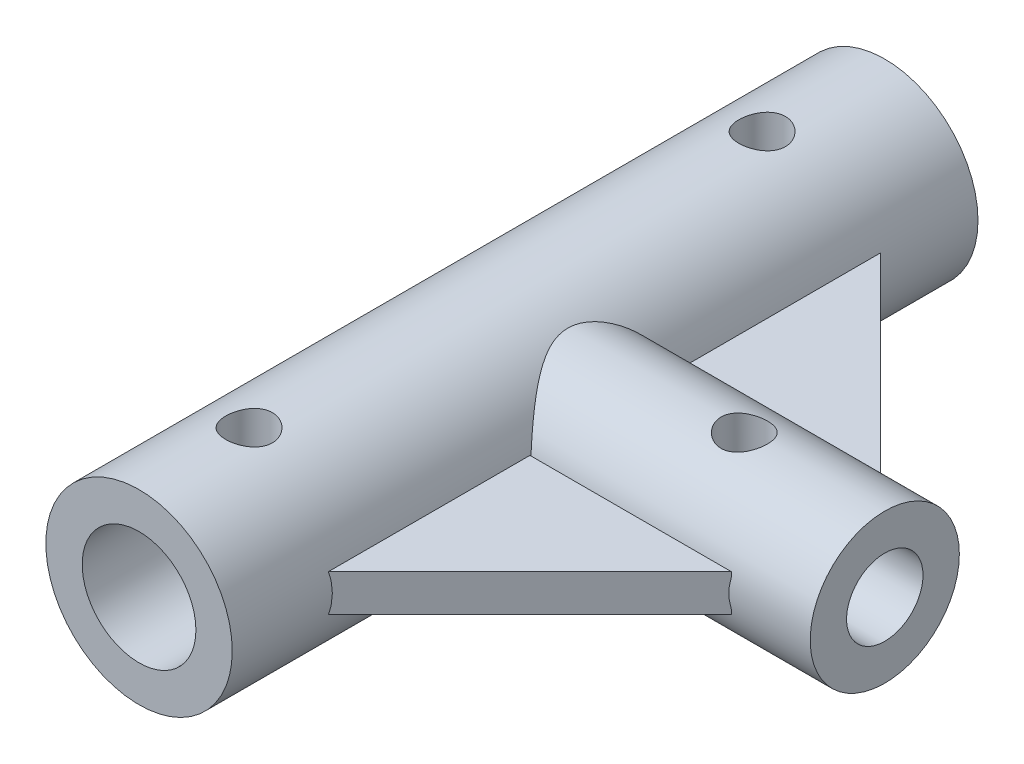
from build123d import *

# Parameters (mm, degrees)
SKETCH1_R                      = 5
SKETCH1_R_2                    = 3.05
BOSS_EXTRUDE1_DEPTH            = 20
BOSS_EXTRUDE2_START            = -20
SKETCH1_2_R                    = 5
SKETCH1_2_R_2                  = 3.05
BOSS_EXTRUDE2_DEPTH            = 20
SKETCH2_R                      = 4
SKETCH2_R_2                    = 2.05
BOSS_EXTRUDE3_DEPTH            = 20
CUT_EXTRUDE1_START             = -20
SKETCH3_R                      = 2.05
CUT_EXTRUDE1_DEPTH             = 20
SKETCH4_R                      = 3.05
CUT_EXTRUDE2_DEPTH             = 46.000000144
M3X0_5_TAPPED_HOLE1_REACH      = 30.067
M3X0_5_TAPPED_HOLE1_BORE_R     = 1.25
SKETCH7_W                      = 1.25
SKETCH7_H                      = 5
M3X0_5_TAPPED_HOLE2_AT_2_COUNT = 2
M3X0_5_TAPPED_HOLE2_AT_2_PITCH = 27.518358086
BOSS_EXTRUDE4_DEPTH            = 1
BOSS_EXTRUDE4_2_DEPTH          = 1


with BuildPart() as part:
    # Sketch1 → Boss-Extrude1 (new body)
    with BuildSketch(Plane.XY):
        Circle(SKETCH1_R)
        Circle(SKETCH1_R_2, mode=Mode.SUBTRACT)
    extrude(amount=BOSS_EXTRUDE1_DEPTH)

    # Sketch1<2> → Boss-Extrude2 (add)
    with BuildSketch(Plane.XY.offset(BOSS_EXTRUDE2_START)):
        Circle(SKETCH1_2_R)
        Circle(SKETCH1_2_R_2, mode=Mode.SUBTRACT)
    extrude(amount=BOSS_EXTRUDE2_DEPTH)

    # Sketch2 → Boss-Extrude3 (add)
    with BuildSketch(Plane(origin=(0, 0, 0), x_dir=(0, 0, -1), z_dir=(1, 0, 0))):
        Circle(SKETCH2_R)
        with Locations(Location((0, 0, 0), (0, 0, 180))):
            Circle(SKETCH2_R_2, mode=Mode.SUBTRACT)
    extrude(amount=BOSS_EXTRUDE3_DEPTH)

    # Sketch3 → Cut-Extrude1 (cut)
    with BuildSketch(Plane(origin=(20, 0, 0), x_dir=(0, 0, -1), z_dir=(1, 0, 0)).offset(CUT_EXTRUDE1_START)):
        Circle(SKETCH3_R)
    extrude(amount=CUT_EXTRUDE1_DEPTH, mode=Mode.SUBTRACT)

    # Sketch4 → Cut-Extrude2 (cut, through all)
    with BuildSketch(Plane.XY.offset(20)):
        Circle(SKETCH4_R)
    extrude(amount=-CUT_EXTRUDE2_DEPTH, mode=Mode.SUBTRACT)

    # M3x0.5 Tapped Hole1 bore (on position points) → M3x0.5 Tapped Hole1 (cut, up to next)
    with BuildSketch(Plane(origin=(12.488759404, 3.999932689, 0.023205297), x_dir=(0, -0.005801324205, 0.999983172177), z_dir=(0, 0.999983172177, 0.005801324205)), mode=Mode.PRIVATE) as m3x0_5_tapped_hole1_sk1:
        Circle(M3X0_5_TAPPED_HOLE1_BORE_R)
    m3x0_5_tapped_hole1_tool1 = extrude(m3x0_5_tapped_hole1_sk1.sketch, amount=-M3X0_5_TAPPED_HOLE1_REACH, mode=Mode.PRIVATE) & part.part
    add(m3x0_5_tapped_hole1_tool1.solids().sort_by_distance((12.488759, 3.999933, 0.023205))[0], mode=Mode.SUBTRACT)

    # Sketch7 → M3x0.5 Tapped Hole2 (revolve, cut)
    with BuildSketch(Plane(origin=(0, 0, -13.417622701), x_dir=(0, 0, -1), z_dir=(1, 0, 0))):
        with Locations((0.625, 2.5)):
            Rectangle(SKETCH7_W, SKETCH7_H)
    m3x0_5_tapped_hole2 = revolve(axis=Axis((0, -6.35, -13.417622701), (0, 1, 0)), mode=Mode.SUBTRACT)

    # M3x0.5 Tapped Hole2 at 2: M3x0.5 Tapped Hole2 ×2
    with Locations(*[(0, 0, i * M3X0_5_TAPPED_HOLE2_AT_2_PITCH) for i in range(1, M3X0_5_TAPPED_HOLE2_AT_2_COUNT)]):
        add(m3x0_5_tapped_hole2, mode=Mode.SUBTRACT)


with BuildPart() as body_2:
    # Sketch11 → Boss-Extrude4 (new, symmetric)
    with BuildSketch(Plane(origin=(0, 0, 0), x_dir=(-1, 0, 0), z_dir=(0, -1, 0))):
        Polygon((-4.702423176, -14.930219956), (-4.702423176, -3.930219956), (-15.702423176, -3.930219956), align=None)
    extrude(amount=BOSS_EXTRUDE4_DEPTH, both=True)


with BuildPart() as body_3:
    # Sketch11 → Boss-Extrude4 2 (new, symmetric)
    with BuildSketch(Plane(origin=(0, 0, 0), x_dir=(-1, 0, 0), z_dir=(0, -1, 0))):
        Polygon((-4.702423176, 4.069780044), (-4.702423176, 15.069780044), (-15.702423176, 4.069780044), align=None)
    extrude(amount=BOSS_EXTRUDE4_2_DEPTH, both=True)


solid = Compound([part.part, body_2.part, body_3.part])
